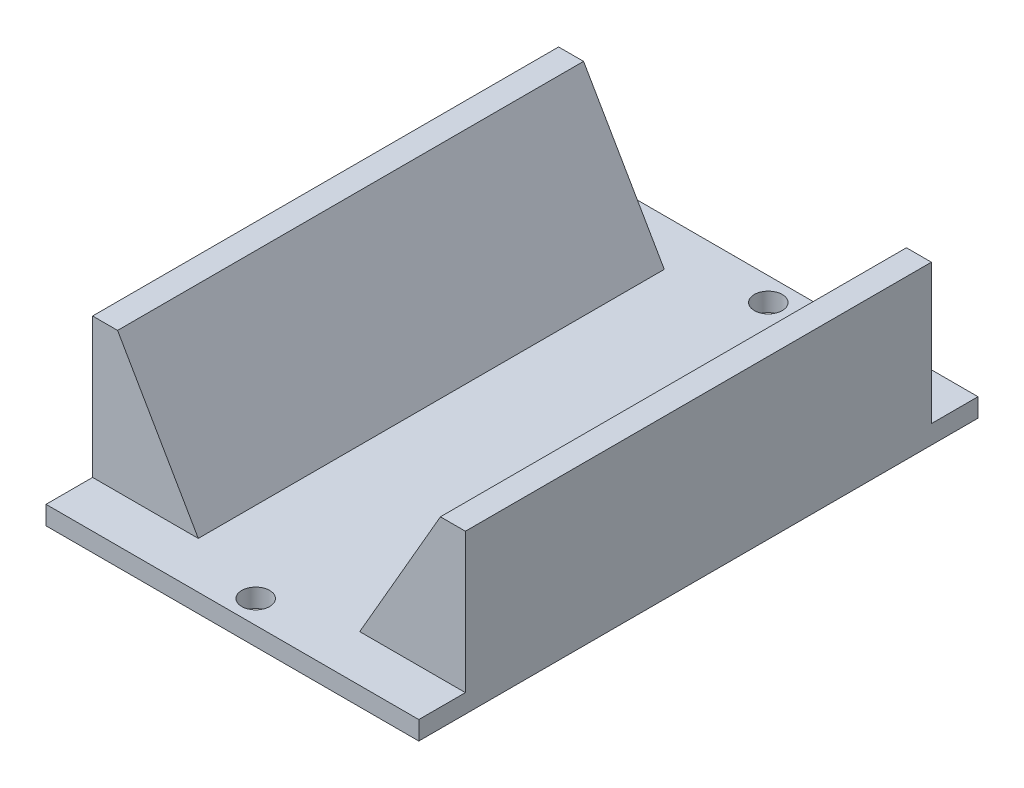
from build123d import *

# Parameters (mm, degrees)
BOSS_EXTRUDE1_DEPTH = 50
SKETCH3_W           = 40
SKETCH3_H           = 2
BOSS_EXTRUDE2_DEPTH = 5
CUT_EXTRUDE1_REACH  = 62.415
SKETCH4_R           = 1.5


with BuildPart() as part:
    # Sketch1 → Boss-Extrude1 (new body)
    with BuildSketch(Plane.XY):
        Polygon((8.660254038, -15), (17.320508076, 0), (20, 0), (20, -17), (-20, -17), (-20, 0), (-17.320508076, 0), (-8.660254038, -15), align=None)
    extrude(amount=BOSS_EXTRUDE1_DEPTH)

    # Sketch3 → Boss-Extrude2 (add)
    with BuildSketch(Plane.XY.offset(50)):
        with Locations((0, -16)):
            Rectangle(SKETCH3_W, SKETCH3_H)
    boss_extrude2 = extrude(amount=BOSS_EXTRUDE2_DEPTH)

    # Sketch4 → Cut-Extrude1 (cut, up to next)
    with BuildSketch(Plane(origin=(0, -15, 0), x_dir=(1, 0, 0), z_dir=(0, 1, 0)), mode=Mode.PRIVATE) as cut_extrude1_sk1:
        with Locations(Location((0, -52.5, 0), (0, 0, 270))):
            Circle(SKETCH4_R)
    cut_extrude1_tool1 = extrude(cut_extrude1_sk1.sketch, amount=-CUT_EXTRUDE1_REACH, mode=Mode.PRIVATE) & part.part
    cut_extrude1 = cut_extrude1_tool1.solids().sort_by_distance((0, -15, 52.5))[0]
    add(cut_extrude1, mode=Mode.SUBTRACT)

    # Mirror1: Boss-Extrude2, Cut-Extrude1 across plane
    add(boss_extrude2.mirror(Plane.XY.offset(25)))
    add(cut_extrude1.mirror(Plane.XY.offset(25)), mode=Mode.SUBTRACT)


solid = part.part
